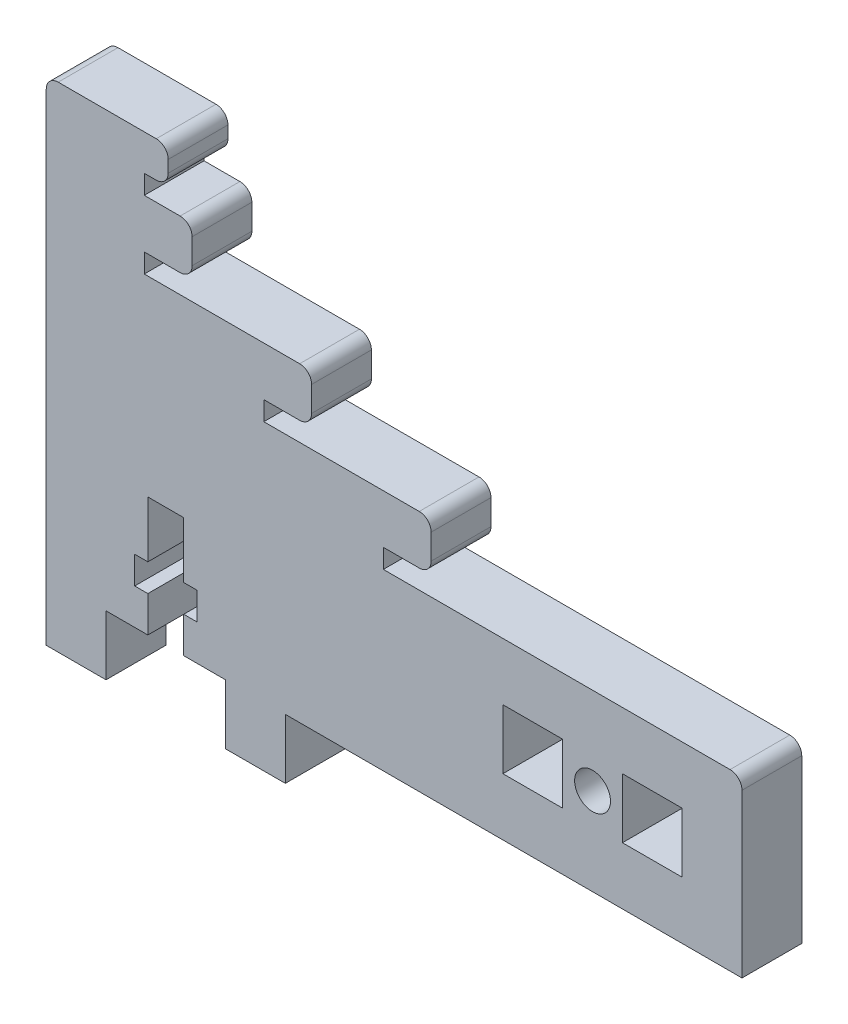
from build123d import *

# Parameters (mm, degrees)
SKETCH1_R           = 1.5
SKETCH1_W           = 5
SKETCH1_H           = 5
BOSS_EXTRUDE1_DEPTH = 5
FILLET3_R           = 1


with BuildPart() as part:
    # Sketch1 → Boss-Extrude1 (new body)
    with BuildSketch(Plane.XY):
        Polygon((0, 5), (0, 19.982808697), (0, 25.3), (0, 30.1), (0, 41.3), (10.2, 41.3), (10.2, 38.3), (8.2, 38.3), (8.2, 36.7), (12.2, 36.7), (12.2, 32.6), (8.2, 32.6), (8.2, 31), (22.2, 31), (22.2, 26.9), (18.2, 26.9), (18.2, 25.3), (32.2, 25.3), (32.2, 21.2), (28.2, 21.2), (28.2, 19.6), (58.2, 19.6), (58.2, 5), (20, 5), (20, 0), (15, 0), (15, 5), (11.5, 5), (11.5, 8), (12.6, 8), (12.6, 10.3), (11.5, 10.3), (11.5, 15), (8.5, 15), (8.5, 10.3), (7.4, 10.3), (7.4, 8), (8.5, 8), (8.5, 5), (5, 5), (5, 0), (0, 0), align=None)
        with Locations((45.7, 12.3)):
            Circle(SKETCH1_R, mode=Mode.SUBTRACT)
        with Locations((40.7, 12.3)):
            Rectangle(SKETCH1_W, SKETCH1_H, mode=Mode.SUBTRACT)
        with Locations((50.7, 12.3)):
            Rectangle(SKETCH1_W, SKETCH1_H, mode=Mode.SUBTRACT)
    extrude(amount=BOSS_EXTRUDE1_DEPTH)

    # Fillet3
    fillet3_edges = [part.edges().sort_by_distance(p)[0] for p in [
        (0, 41.3, 2.5),
        (10.2, 41.3, 2.5),
        (10.2, 38.3, 2.5),
        (12.2, 36.7, 2.5),
        (12.2, 32.6, 2.5),
        (22.2, 31, 2.5),
        (22.2, 26.9, 2.5),
        (32.2, 25.3, 2.5),
        (32.2, 21.2, 2.5),
        (58.2, 19.6, 2.5),
    ]]
    fillet(fillet3_edges, radius=FILLET3_R)


solid = part.part
